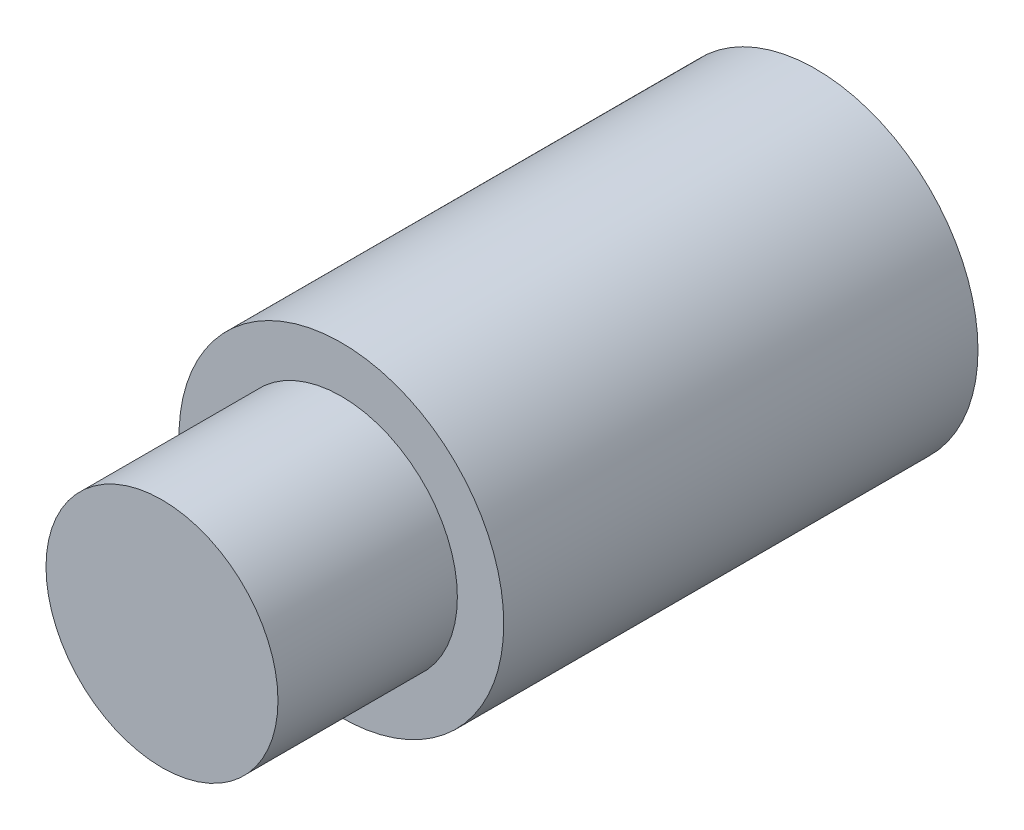
from build123d import *

# Parameters (mm, degrees)
SKETCH1_R           = 4.0005
BOSS_EXTRUDE1_DEPTH = 11.684
SKETCH2_R           = 2.8575
BOSS_EXTRUDE2_DEPTH = 4.4196


with BuildPart() as part:
    # Sketch1 → Boss-Extrude1 (new body)
    with BuildSketch(Plane.XY):
        Circle(SKETCH1_R)
    extrude(amount=BOSS_EXTRUDE1_DEPTH)

    # Sketch2 → Boss-Extrude2 (add)
    with BuildSketch(Plane.XY.offset(11.684)):
        Circle(SKETCH2_R)
    extrude(amount=BOSS_EXTRUDE2_DEPTH)


solid = part.part
